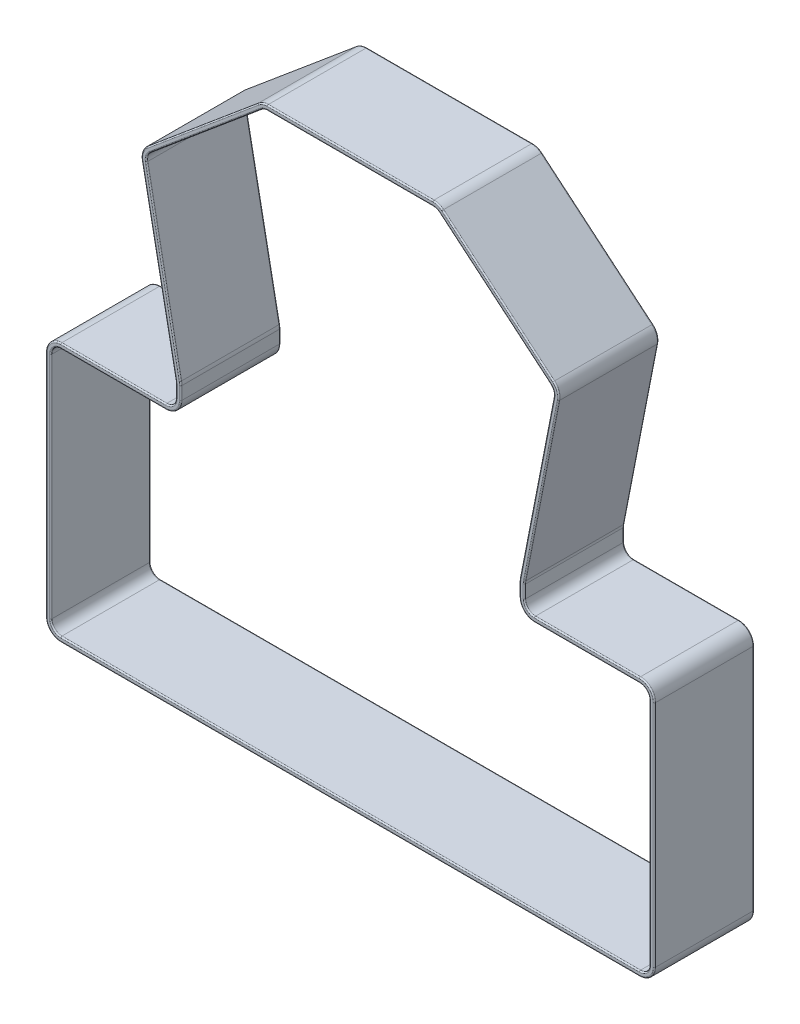
from build123d import *


with BuildPart() as part:
    # Sweep2: sweep along a path in Sketch1
    with BuildLine(Plane.XY) as sweep2_path:
        Line((8.3, 10), (-8.3, 10))
        ThreePointArc((-8.3, 10), (-8.64151408, 9.939876658), (-8.941962225, 9.766736266))
        Line((-8.941962225, 9.766736266), (-20.059730236, 0.45820685))
        ThreePointArc((-20.059730236, 0.45820685), (-20.360342227, 0.02546736), (-20.399266363, -0.5))
        Line((-20.399266363, -0.5), (-17.012657372, -17.860113915))
        ThreePointArc((-17.012657372, -17.860113915), (-16.984926395, -18.050692676), (-16.975654077, -18.243055082))
        Line((-16.975654077, -18.243055082), (-16.975654077, -19.529933071))
        ThreePointArc((-16.975654077, -19.529933071), (-17.414993905, -20.590593243), (-18.475654077, -21.029933071))
        Line((-18.475654077, -21.029933071), (-29, -21.029933071))
        ThreePointArc((-29, -21.029933071), (-29.707106781, -21.32282629), (-30, -22.029933071))
        Line((-30, -22.029933071), (-30, -44.99846681))
        ThreePointArc((-30, -44.99846681), (-29.707106781, -45.705573591), (-29, -45.99846681))
        Line((-29, -45.99846681), (29, -45.99846681))
        ThreePointArc((29, -45.99846681), (29.707106781, -45.705573591), (30, -44.99846681))
        Line((30, -44.99846681), (30, -22.029933071))
        ThreePointArc((30, -22.029933071), (29.707106781, -21.32282629), (29, -21.029933071))
        Line((29, -21.029933071), (18.475654077, -21.029933071))
        ThreePointArc((18.475654077, -21.029933071), (17.414993905, -20.590593243), (16.975654077, -19.529933071))
        Line((16.975654077, -19.529933071), (16.975654077, -18.243055082))
        ThreePointArc((16.975654077, -18.243055082), (16.984926395, -18.050692676), (17.012657372, -17.860113915))
        Line((17.012657372, -17.860113915), (20.399266363, -0.5))
        ThreePointArc((20.399266363, -0.5), (20.360342227, 0.02546736), (20.059730236, 0.45820685))
        Line((20.059730236, 0.45820685), (8.941962225, 9.766736266))
        ThreePointArc((8.941962225, 9.766736266), (8.64151408, 9.939876658), (8.3, 10))
    # Sketch2 → Sweep2 (sweep)
    with BuildSketch(Plane(origin=(0, 0, 0), x_dir=(0, 0, -1), z_dir=(1, 0, 0))):
        with BuildLine():
            Line((-4.875, 10.5), (4.875, 10.5))
            ThreePointArc((4.875, 10.5), (4.963388348, 10.463388348), (5, 10.375))
            Line((5, 10.375), (5, 10.125))
            ThreePointArc((5, 10.125), (4.963388348, 10.036611652), (4.875, 10))
            Line((4.875, 10), (-4.875, 10))
            ThreePointArc((-4.875, 10), (-4.963388348, 10.036611652), (-5, 10.125))
            Line((-5, 10.125), (-5, 10.375))
            ThreePointArc((-5, 10.375), (-4.963388348, 10.463388348), (-4.875, 10.5))
        make_face()
    sweep(path=sweep2_path.line)


solid = part.part
